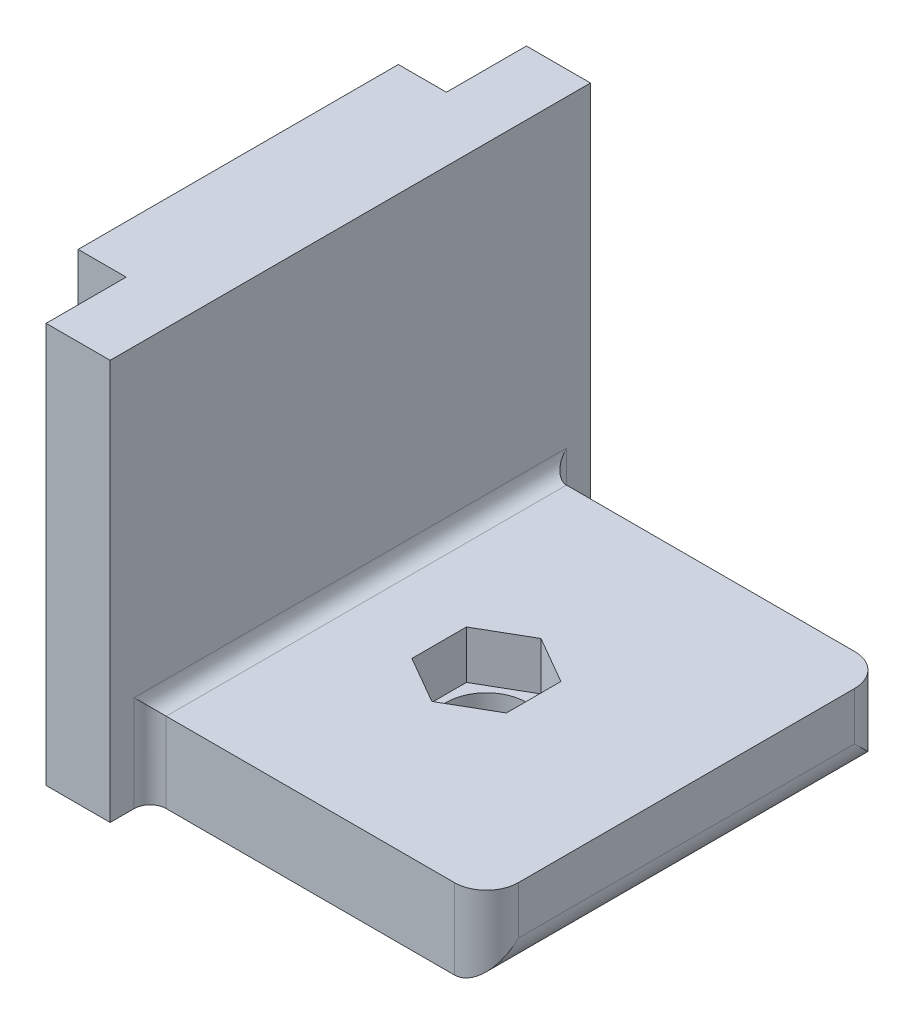
from build123d import *

# Parameters (mm, degrees)
BOSS_EXTRUDE1_DEPTH     = 5
BOSS_EXTRUDE2_DEPTH     = 20
CUT_EXTRUDE1_DEPTH      = 34.018933962
CUT_EXTRUDE1_DEPTH_BACK = 34.018933962
SKETCH4_R               = 2.5
FILLET1_R               = 1
FILLET2_R               = 1
FILLET3_R               = 2
CUT_EXTRUDE2_DEPTH      = 3


with BuildPart() as part:
    # Sketch2 → Boss-Extrude1 (new body)
    with BuildSketch(Plane(origin=(0, 0, 0), x_dir=(1, 0, 0), z_dir=(0, 1, 0))):
        Polygon((-8.5, -12.5), (12.5, -12.5), (12.5, 12.5), (-8.5, 12.5), (-8.5, 15), (-12.5, 15), (-12.5, 10), (-15.5, 10), (-15.5, -10), (-12.5, -10), (-12.5, -15), (-8.5, -15), align=None)
    extrude(amount=BOSS_EXTRUDE1_DEPTH)

    # Sketch3 → Boss-Extrude2 (add)
    with BuildSketch(Plane(origin=(0, 5, 0), x_dir=(1, 0, 0), z_dir=(0, 1, 0))):
        Polygon((-15.5, 10), (-15.5, -10), (-12.5, -10), (-12.5, -15), (-8.5, -15), (-8.5, 15), (-12.5, 15), (-12.5, 10), align=None)
    extrude(amount=BOSS_EXTRUDE2_DEPTH)

    # Sketch4 → Cut-Extrude1 (cut, two sides: drawn at the far end of the back side and taken through both)
    with BuildSketch(Plane.XZ.offset(-CUT_EXTRUDE1_DEPTH_BACK)):
        with Locations(Location((0, 0, 0), (0, 0, 270))):
            Circle(SKETCH4_R)
    extrude(amount=CUT_EXTRUDE1_DEPTH + CUT_EXTRUDE1_DEPTH_BACK, mode=Mode.SUBTRACT)

    # Fillet1
    fillet1_edges = [part.edges().sort_by_distance(p)[0] for p in [
        (0, 0, 2.5),
    ]]
    fillet(fillet1_edges, radius=FILLET1_R)

    # Fillet2
    fillet2_edges = [part.edges().sort_by_distance(p)[0] for p in [
        (-8.5, 2.5, -12.5),
        (-8.5, 2.5, 12.5),
        (-8.5, 5, 0),
    ]]
    fillet(fillet2_edges, radius=FILLET2_R)

    # Fillet3
    fillet3_edges = [part.edges().sort_by_distance(p)[0] for p in [
        (12.5, 0, 0),
        (12.5, 2.5, -12.5),
        (12.5, 2.5, 12.5),
    ]]
    fillet(fillet3_edges, radius=FILLET3_R)

    # Sketch5 → Cut-Extrude2 (cut)
    with BuildSketch(Plane(origin=(0, 5, 0), x_dir=(1, 0, 0), z_dir=(0, 1, 0))):
        Polygon((2.95, 1.703183294), (0, 3.406366588), (-2.95, 1.703183294), (-2.95, -1.703183294), (0, -3.406366588), (2.95, -1.703183294), align=None)
    extrude(amount=-CUT_EXTRUDE2_DEPTH, mode=Mode.SUBTRACT)


solid = part.part
